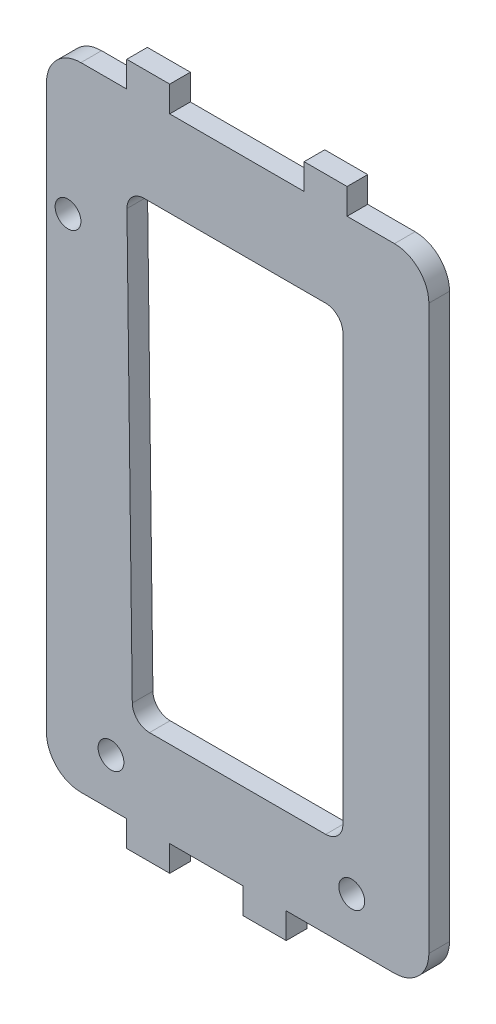
from build123d import *

# Parameters (mm, degrees)
CROQUIS1_R              = 1.5
SALIENTE_EXTRUIR1_DEPTH = 2.4


with BuildPart() as part:
    # Croquis1 → Saliente-Extruir1 (new body)
    with BuildSketch(Plane.XY):
        with BuildLine():
            Line((-27.735211809, 52.645866632), (-43.365211809, 52.645866632))
            Line((-43.365211809, 52.645866632), (-43.365211809, 55.645866632))
            Line((-43.365211809, 55.645866632), (-48.365211809, 55.645866632))
            Line((-48.365211809, 55.645866632), (-48.365211809, 52.645866632))
            Line((-48.365211809, 52.645866632), (-53.695211809, 52.645866632))
            ThreePointArc((-53.695211809, 52.645866632), (-56.523638933, 51.474293757), (-57.695211809, 48.645866632))
            Line((-57.695211809, 48.645866632), (-57.695211809, -16.854133368))
            ThreePointArc((-57.695211809, -16.854133368), (-56.523638933, -19.682560493), (-53.695211809, -20.854133368))
            Line((-53.695211809, -20.854133368), (-48.365211809, -20.854133368))
            Line((-48.365211809, -20.854133368), (-48.365211809, -23.854133368))
            Line((-48.365211809, -23.854133368), (-43.365211809, -23.854133368))
            Line((-43.365211809, -23.854133368), (-43.365211809, -20.854133368))
            Line((-43.365211809, -20.854133368), (-34.815211809, -20.854133368))
            Line((-34.815211809, -20.854133368), (-34.815211809, -23.854133368))
            Line((-34.815211809, -23.854133368), (-29.815211809, -23.854133368))
            Line((-29.815211809, -23.854133368), (-29.815211809, -20.854133368))
            Line((-29.815211809, -20.854133368), (-17.225211809, -20.854133368))
            ThreePointArc((-17.225211809, -20.854133368), (-14.396784684, -19.682560493), (-13.225211809, -16.854133368))
            Line((-13.225211809, -16.854133368), (-13.225211809, 48.645866632))
            ThreePointArc((-13.225211809, 48.645866632), (-14.396784684, 51.474293757), (-17.225211809, 52.645866632))
            Line((-17.225211809, 52.645866632), (-22.735211809, 52.645866632))
            Line((-22.735211809, 52.645866632), (-22.735211809, 55.645866632))
            Line((-22.735211809, 55.645866632), (-27.735211809, 55.645866632))
            Line((-27.735211809, 55.645866632), (-27.735211809, 52.645866632))
        make_face()
        with Locations((-55.195211809, 36.645866632)):
            Circle(CROQUIS1_R, mode=Mode.SUBTRACT)
        with Locations((-50.195211809, -15.354133368)):
            Circle(CROQUIS1_R, mode=Mode.SUBTRACT)
        with Locations((-22.195211809, -15.354133368)):
            Circle(CROQUIS1_R, mode=Mode.SUBTRACT)
        with BuildLine():
            Line((-35.550211809, 42.645866632), (-25.225211809, 42.645866632))
            ThreePointArc((-25.225211809, 42.645866632), (-23.810998246, 42.060080194), (-23.225211809, 40.645866632))
            Line((-23.225211809, 40.645866632), (-23.225211809, -8.854133368))
            ThreePointArc((-23.225211809, -8.854133368), (-23.810998246, -10.26834693), (-25.225211809, -10.854133368))
            Line((-25.225211809, -10.854133368), (-45.720101709, -10.854133368))
            ThreePointArc((-45.720101709, -10.854133368), (-47.125432715, -10.277174044), (-47.719944893, -8.879178133))
            Line((-47.719944893, -8.879178133), (-48.339851435, 40.620821867))
            ThreePointArc((-48.339851435, 40.620821867), (-47.763048927, 42.051197638), (-46.340008251, 42.645866632))
            Line((-46.340008251, 42.645866632), (-35.550211809, 42.645866632))
        make_face(mode=Mode.SUBTRACT)
    extrude(amount=SALIENTE_EXTRUIR1_DEPTH)


solid = part.part
